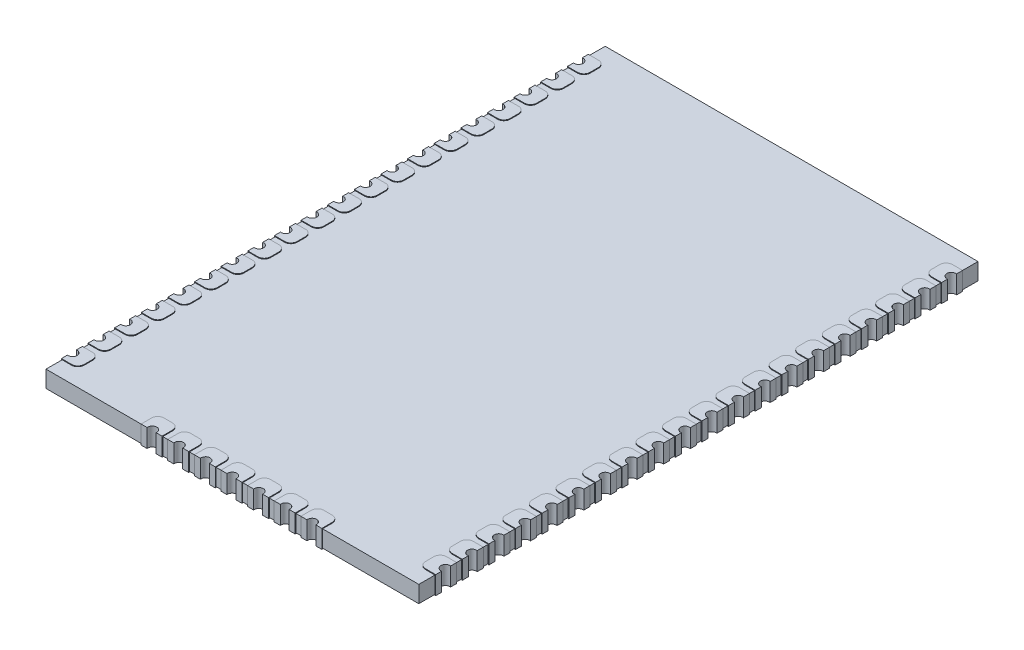
from build123d import *

# Parameters (mm, degrees)
SKETCH1_W                   = 17.78
SKETCH1_H                   = 26.67
BOSS_EXTRUDE1_DEPTH         = 0.8
SKETCH2_R                   = 0.25
CUT_EXTRUDE1_DEPTH          = 1
BOSS_EXTRUDE2_DEPTH         = 0.035
BOSS_EXTRUDE2_DEPTH_BACK    = 0.835
BOSS_EXTRUDE2_2_DEPTH       = 0.035
BOSS_EXTRUDE2_2_DEPTH_BACK  = 0.835
BOSS_EXTRUDE2_3_DEPTH       = 0.035
BOSS_EXTRUDE2_3_DEPTH_BACK  = 0.835
BOSS_EXTRUDE2_4_DEPTH       = 0.035
BOSS_EXTRUDE2_4_DEPTH_BACK  = 0.835
BOSS_EXTRUDE2_5_DEPTH       = 0.035
BOSS_EXTRUDE2_5_DEPTH_BACK  = 0.835
BOSS_EXTRUDE2_6_DEPTH       = 0.035
BOSS_EXTRUDE2_6_DEPTH_BACK  = 0.835
BOSS_EXTRUDE2_7_DEPTH       = 0.035
BOSS_EXTRUDE2_7_DEPTH_BACK  = 0.835
BOSS_EXTRUDE2_8_DEPTH       = 0.035
BOSS_EXTRUDE2_8_DEPTH_BACK  = 0.835
BOSS_EXTRUDE2_9_DEPTH       = 0.035
BOSS_EXTRUDE2_9_DEPTH_BACK  = 0.835
BOSS_EXTRUDE2_10_DEPTH      = 0.035
BOSS_EXTRUDE2_10_DEPTH_BACK = 0.835
BOSS_EXTRUDE2_11_DEPTH      = 0.035
BOSS_EXTRUDE2_11_DEPTH_BACK = 0.835
BOSS_EXTRUDE2_12_DEPTH      = 0.035
BOSS_EXTRUDE2_12_DEPTH_BACK = 0.835
BOSS_EXTRUDE2_13_DEPTH      = 0.035
BOSS_EXTRUDE2_13_DEPTH_BACK = 0.835
BOSS_EXTRUDE2_14_DEPTH      = 0.035
BOSS_EXTRUDE2_14_DEPTH_BACK = 0.835
BOSS_EXTRUDE2_15_DEPTH      = 0.035
BOSS_EXTRUDE2_15_DEPTH_BACK = 0.835
BOSS_EXTRUDE2_16_DEPTH      = 0.035
BOSS_EXTRUDE2_16_DEPTH_BACK = 0.835
BOSS_EXTRUDE2_17_DEPTH      = 0.035
BOSS_EXTRUDE2_17_DEPTH_BACK = 0.835
BOSS_EXTRUDE2_18_DEPTH      = 0.035
BOSS_EXTRUDE2_18_DEPTH_BACK = 0.835
BOSS_EXTRUDE2_19_DEPTH      = 0.035
BOSS_EXTRUDE2_19_DEPTH_BACK = 0.835
BOSS_EXTRUDE2_20_DEPTH      = 0.035
BOSS_EXTRUDE2_20_DEPTH_BACK = 0.835
BOSS_EXTRUDE2_21_DEPTH      = 0.035
BOSS_EXTRUDE2_21_DEPTH_BACK = 0.835
BOSS_EXTRUDE2_22_DEPTH      = 0.035
BOSS_EXTRUDE2_22_DEPTH_BACK = 0.835
BOSS_EXTRUDE2_23_DEPTH      = 0.035
BOSS_EXTRUDE2_23_DEPTH_BACK = 0.835
BOSS_EXTRUDE2_24_DEPTH      = 0.035
BOSS_EXTRUDE2_24_DEPTH_BACK = 0.835
BOSS_EXTRUDE2_25_DEPTH      = 0.035
BOSS_EXTRUDE2_25_DEPTH_BACK = 0.835
BOSS_EXTRUDE2_26_DEPTH      = 0.035
BOSS_EXTRUDE2_26_DEPTH_BACK = 0.835
BOSS_EXTRUDE2_27_DEPTH      = 0.035
BOSS_EXTRUDE2_27_DEPTH_BACK = 0.835
BOSS_EXTRUDE2_28_DEPTH      = 0.035
BOSS_EXTRUDE2_28_DEPTH_BACK = 0.835
BOSS_EXTRUDE2_29_DEPTH      = 0.035
BOSS_EXTRUDE2_29_DEPTH_BACK = 0.835
BOSS_EXTRUDE2_30_DEPTH      = 0.035
BOSS_EXTRUDE2_30_DEPTH_BACK = 0.835
BOSS_EXTRUDE2_31_DEPTH      = 0.035
BOSS_EXTRUDE2_31_DEPTH_BACK = 0.835
BOSS_EXTRUDE2_32_DEPTH      = 0.035
BOSS_EXTRUDE2_32_DEPTH_BACK = 0.835
BOSS_EXTRUDE2_33_DEPTH      = 0.035
BOSS_EXTRUDE2_33_DEPTH_BACK = 0.835
BOSS_EXTRUDE2_34_DEPTH      = 0.035
BOSS_EXTRUDE2_34_DEPTH_BACK = 0.835
BOSS_EXTRUDE2_35_DEPTH      = 0.035
BOSS_EXTRUDE2_35_DEPTH_BACK = 0.835
BOSS_EXTRUDE2_36_DEPTH      = 0.035
BOSS_EXTRUDE2_36_DEPTH_BACK = 0.835
BOSS_EXTRUDE2_37_DEPTH      = 0.035
BOSS_EXTRUDE2_37_DEPTH_BACK = 0.835
BOSS_EXTRUDE2_38_DEPTH      = 0.035
BOSS_EXTRUDE2_38_DEPTH_BACK = 0.835
BOSS_EXTRUDE2_39_DEPTH      = 0.035
BOSS_EXTRUDE2_39_DEPTH_BACK = 0.835
BOSS_EXTRUDE2_40_DEPTH      = 0.035
BOSS_EXTRUDE2_40_DEPTH_BACK = 0.835
BOSS_EXTRUDE2_41_DEPTH      = 0.035
BOSS_EXTRUDE2_41_DEPTH_BACK = 0.835
BOSS_EXTRUDE2_42_DEPTH      = 0.035
BOSS_EXTRUDE2_42_DEPTH_BACK = 0.835
BOSS_EXTRUDE2_43_DEPTH      = 0.035
BOSS_EXTRUDE2_43_DEPTH_BACK = 0.835
BOSS_EXTRUDE2_44_DEPTH      = 0.035
BOSS_EXTRUDE2_44_DEPTH_BACK = 0.835
BOSS_EXTRUDE2_45_DEPTH      = 0.035
BOSS_EXTRUDE2_45_DEPTH_BACK = 0.835
BOSS_EXTRUDE2_46_DEPTH      = 0.035
BOSS_EXTRUDE2_46_DEPTH_BACK = 0.835
BOSS_EXTRUDE2_47_DEPTH      = 0.035
BOSS_EXTRUDE2_47_DEPTH_BACK = 0.835


with BuildPart() as part:
    # Sketch1 → Boss-Extrude1 (new body)
    with BuildSketch(Plane(origin=(0, 0, 0), x_dir=(1, 0, 0), z_dir=(0, 1, 0))):
        Rectangle(SKETCH1_W, SKETCH1_H)
    extrude(amount=BOSS_EXTRUDE1_DEPTH)

    # Sketch2 → Cut-Extrude1 (cut)
    with BuildSketch(Plane.XZ):
        with Locations((-8.89, -12.065)):
            Circle(SKETCH2_R)
        with Locations((-8.89, -10.795)):
            Circle(SKETCH2_R)
        with Locations((-8.89, -9.525)):
            Circle(SKETCH2_R)
        with Locations((-8.89, -8.255)):
            Circle(SKETCH2_R)
        with Locations((-8.89, -6.985)):
            Circle(SKETCH2_R)
        with Locations((-8.89, -5.715)):
            Circle(SKETCH2_R)
        with Locations((-8.89, -4.445)):
            Circle(SKETCH2_R)
        with Locations((-8.89, -3.175)):
            Circle(SKETCH2_R)
        with Locations((-8.89, -1.905)):
            Circle(SKETCH2_R)
        with Locations((-8.89, -0.635)):
            Circle(SKETCH2_R)
        with Locations((-8.89, 0.635)):
            Circle(SKETCH2_R)
        with Locations((-8.89, 1.905)):
            Circle(SKETCH2_R)
        with Locations((-8.89, 3.175)):
            Circle(SKETCH2_R)
        with Locations((-8.89, 4.445)):
            Circle(SKETCH2_R)
        with Locations((-8.89, 5.715)):
            Circle(SKETCH2_R)
        with Locations((-8.89, 6.985)):
            Circle(SKETCH2_R)
        with Locations((-8.89, 8.255)):
            Circle(SKETCH2_R)
        with Locations((-8.89, 9.525)):
            Circle(SKETCH2_R)
        with Locations((-8.89, 10.795)):
            Circle(SKETCH2_R)
        with Locations((-8.89, 12.065)):
            Circle(SKETCH2_R)
        with Locations((8.89, -10.795)):
            Circle(SKETCH2_R)
        with Locations((8.89, -9.525)):
            Circle(SKETCH2_R)
        with Locations((8.89, -8.255)):
            Circle(SKETCH2_R)
        with Locations((8.89, -6.985)):
            Circle(SKETCH2_R)
        with Locations((8.89, -5.715)):
            Circle(SKETCH2_R)
        with Locations((8.89, -4.445)):
            Circle(SKETCH2_R)
        with Locations((8.89, -3.175)):
            Circle(SKETCH2_R)
        with Locations((8.89, -1.905)):
            Circle(SKETCH2_R)
        with Locations((8.89, -0.635)):
            Circle(SKETCH2_R)
        with Locations((8.89, 0.635)):
            Circle(SKETCH2_R)
        with Locations((8.89, 1.905)):
            Circle(SKETCH2_R)
        with Locations((8.89, 3.175)):
            Circle(SKETCH2_R)
        with Locations((8.89, 4.445)):
            Circle(SKETCH2_R)
        with Locations((8.89, 5.715)):
            Circle(SKETCH2_R)
        with Locations((8.89, 6.985)):
            Circle(SKETCH2_R)
        with Locations((8.89, 8.255)):
            Circle(SKETCH2_R)
        with Locations((8.89, 9.525)):
            Circle(SKETCH2_R)
        with Locations((8.89, 10.795)):
            Circle(SKETCH2_R)
        with Locations((8.89, 12.065)):
            Circle(SKETCH2_R)
        with Locations((8.89, -12.065)):
            Circle(SKETCH2_R)
        with Locations((-3.81, 13.335)):
            Circle(SKETCH2_R)
        with Locations((-2.54, 13.335)):
            Circle(SKETCH2_R)
        with Locations((-1.27, 13.335)):
            Circle(SKETCH2_R)
        with Locations((0, 13.335)):
            Circle(SKETCH2_R)
        with Locations((1.27, 13.335)):
            Circle(SKETCH2_R)
        with Locations((2.54, 13.335)):
            Circle(SKETCH2_R)
        with Locations((3.81, 13.335)):
            Circle(SKETCH2_R)
    extrude(amount=-CUT_EXTRUDE1_DEPTH, mode=Mode.SUBTRACT)


with BuildPart() as body_2:
    # Sketch3 → Boss-Extrude2 (new, two sides: drawn at the far end of the back side and taken through both)
    with BuildSketch(Plane.XZ.offset(-BOSS_EXTRUDE2_DEPTH_BACK)):
        with BuildLine():
            Line((-8.89, 11.565), (-8.44, 11.565))
            ThreePointArc((-8.44, 11.565), (-8.227867966, 11.652867966), (-8.14, 11.865))
            Line((-8.14, 11.865), (-8.14, 12.265))
            ThreePointArc((-8.14, 12.265), (-8.227867966, 12.477132034), (-8.44, 12.565))
            Line((-8.44, 12.565), (-8.89, 12.565))
            Line((-8.89, 12.565), (-8.925, 12.565))
            Line((-8.925, 12.565), (-8.925, 12.277132034))
            ThreePointArc((-8.925, 12.277132034), (-8.675, 12.065), (-8.925, 11.852867966))
            Line((-8.925, 11.852867966), (-8.925, 11.565))
            Line((-8.925, 11.565), (-8.89, 11.565))
        make_face()
    extrude(amount=BOSS_EXTRUDE2_DEPTH + BOSS_EXTRUDE2_DEPTH_BACK)


with BuildPart() as body_3:
    # Sketch3 → Boss-Extrude2 2 (new, two sides: drawn at the far end of the back side and taken through both)
    with BuildSketch(Plane.XZ.offset(-BOSS_EXTRUDE2_2_DEPTH_BACK)):
        with BuildLine():
            Line((-8.89, 10.295), (-8.44, 10.295))
            ThreePointArc((-8.44, 10.295), (-8.227867966, 10.382867966), (-8.14, 10.595))
            Line((-8.14, 10.595), (-8.14, 10.995))
            ThreePointArc((-8.14, 10.995), (-8.227867966, 11.207132034), (-8.44, 11.295))
            Line((-8.44, 11.295), (-8.89, 11.295))
            Line((-8.89, 11.295), (-8.925, 11.295))
            Line((-8.925, 11.295), (-8.925, 11.007132034))
            ThreePointArc((-8.925, 11.007132034), (-8.675, 10.795), (-8.925, 10.582867966))
            Line((-8.925, 10.582867966), (-8.925, 10.295))
            Line((-8.925, 10.295), (-8.89, 10.295))
        make_face()
    extrude(amount=BOSS_EXTRUDE2_2_DEPTH + BOSS_EXTRUDE2_2_DEPTH_BACK)


with BuildPart() as body_4:
    # Sketch3 → Boss-Extrude2 3 (new, two sides: drawn at the far end of the back side and taken through both)
    with BuildSketch(Plane.XZ.offset(-BOSS_EXTRUDE2_3_DEPTH_BACK)):
        with BuildLine():
            Line((-8.89, 9.025), (-8.44, 9.025))
            ThreePointArc((-8.44, 9.025), (-8.227867966, 9.112867966), (-8.14, 9.325))
            Line((-8.14, 9.325), (-8.14, 9.725))
            ThreePointArc((-8.14, 9.725), (-8.227867966, 9.937132034), (-8.44, 10.025))
            Line((-8.44, 10.025), (-8.89, 10.025))
            Line((-8.89, 10.025), (-8.925, 10.025))
            Line((-8.925, 10.025), (-8.925, 9.737132034))
            ThreePointArc((-8.925, 9.737132034), (-8.675, 9.525), (-8.925, 9.312867966))
            Line((-8.925, 9.312867966), (-8.925, 9.025))
            Line((-8.925, 9.025), (-8.89, 9.025))
        make_face()
    extrude(amount=BOSS_EXTRUDE2_3_DEPTH + BOSS_EXTRUDE2_3_DEPTH_BACK)


with BuildPart() as body_5:
    # Sketch3 → Boss-Extrude2 4 (new, two sides: drawn at the far end of the back side and taken through both)
    with BuildSketch(Plane.XZ.offset(-BOSS_EXTRUDE2_4_DEPTH_BACK)):
        with BuildLine():
            Line((-8.89, 7.755), (-8.44, 7.755))
            ThreePointArc((-8.44, 7.755), (-8.227867966, 7.842867966), (-8.14, 8.055))
            Line((-8.14, 8.055), (-8.14, 8.455))
            ThreePointArc((-8.14, 8.455), (-8.227867966, 8.667132034), (-8.44, 8.755))
            Line((-8.44, 8.755), (-8.89, 8.755))
            Line((-8.89, 8.755), (-8.925, 8.755))
            Line((-8.925, 8.755), (-8.925, 8.467132034))
            ThreePointArc((-8.925, 8.467132034), (-8.675, 8.255), (-8.925, 8.042867966))
            Line((-8.925, 8.042867966), (-8.925, 7.755))
            Line((-8.925, 7.755), (-8.89, 7.755))
        make_face()
    extrude(amount=BOSS_EXTRUDE2_4_DEPTH + BOSS_EXTRUDE2_4_DEPTH_BACK)


with BuildPart() as body_6:
    # Sketch3 → Boss-Extrude2 5 (new, two sides: drawn at the far end of the back side and taken through both)
    with BuildSketch(Plane.XZ.offset(-BOSS_EXTRUDE2_5_DEPTH_BACK)):
        with BuildLine():
            Line((-8.89, 6.485), (-8.44, 6.485))
            ThreePointArc((-8.44, 6.485), (-8.227867966, 6.572867966), (-8.14, 6.785))
            Line((-8.14, 6.785), (-8.14, 7.185))
            ThreePointArc((-8.14, 7.185), (-8.227867966, 7.397132034), (-8.44, 7.485))
            Line((-8.44, 7.485), (-8.89, 7.485))
            Line((-8.89, 7.485), (-8.925, 7.485))
            Line((-8.925, 7.485), (-8.925, 7.197132034))
            ThreePointArc((-8.925, 7.197132034), (-8.675, 6.985), (-8.925, 6.772867966))
            Line((-8.925, 6.772867966), (-8.925, 6.485))
            Line((-8.925, 6.485), (-8.89, 6.485))
        make_face()
    extrude(amount=BOSS_EXTRUDE2_5_DEPTH + BOSS_EXTRUDE2_5_DEPTH_BACK)


with BuildPart() as body_7:
    # Sketch3 → Boss-Extrude2 6 (new, two sides: drawn at the far end of the back side and taken through both)
    with BuildSketch(Plane.XZ.offset(-BOSS_EXTRUDE2_6_DEPTH_BACK)):
        with BuildLine():
            Line((-8.89, 5.215), (-8.44, 5.215))
            ThreePointArc((-8.44, 5.215), (-8.227867966, 5.302867966), (-8.14, 5.515))
            Line((-8.14, 5.515), (-8.14, 5.915))
            ThreePointArc((-8.14, 5.915), (-8.227867966, 6.127132034), (-8.44, 6.215))
            Line((-8.44, 6.215), (-8.89, 6.215))
            Line((-8.89, 6.215), (-8.925, 6.215))
            Line((-8.925, 6.215), (-8.925, 5.927132034))
            ThreePointArc((-8.925, 5.927132034), (-8.675, 5.715), (-8.925, 5.502867966))
            Line((-8.925, 5.502867966), (-8.925, 5.215))
            Line((-8.925, 5.215), (-8.89, 5.215))
        make_face()
    extrude(amount=BOSS_EXTRUDE2_6_DEPTH + BOSS_EXTRUDE2_6_DEPTH_BACK)


with BuildPart() as body_8:
    # Sketch3 → Boss-Extrude2 7 (new, two sides: drawn at the far end of the back side and taken through both)
    with BuildSketch(Plane.XZ.offset(-BOSS_EXTRUDE2_7_DEPTH_BACK)):
        with BuildLine():
            Line((-8.89, 3.945), (-8.44, 3.945))
            ThreePointArc((-8.44, 3.945), (-8.227867966, 4.032867966), (-8.14, 4.245))
            Line((-8.14, 4.245), (-8.14, 4.645))
            ThreePointArc((-8.14, 4.645), (-8.227867966, 4.857132034), (-8.44, 4.945))
            Line((-8.44, 4.945), (-8.89, 4.945))
            Line((-8.89, 4.945), (-8.925, 4.945))
            Line((-8.925, 4.945), (-8.925, 4.657132034))
            ThreePointArc((-8.925, 4.657132034), (-8.675, 4.445), (-8.925, 4.232867966))
            Line((-8.925, 4.232867966), (-8.925, 3.945))
            Line((-8.925, 3.945), (-8.89, 3.945))
        make_face()
    extrude(amount=BOSS_EXTRUDE2_7_DEPTH + BOSS_EXTRUDE2_7_DEPTH_BACK)


with BuildPart() as body_9:
    # Sketch3 → Boss-Extrude2 8 (new, two sides: drawn at the far end of the back side and taken through both)
    with BuildSketch(Plane.XZ.offset(-BOSS_EXTRUDE2_8_DEPTH_BACK)):
        with BuildLine():
            Line((-8.89, 2.675), (-8.44, 2.675))
            ThreePointArc((-8.44, 2.675), (-8.227867966, 2.762867966), (-8.14, 2.975))
            Line((-8.14, 2.975), (-8.14, 3.375))
            ThreePointArc((-8.14, 3.375), (-8.227867966, 3.587132034), (-8.44, 3.675))
            Line((-8.44, 3.675), (-8.89, 3.675))
            Line((-8.89, 3.675), (-8.925, 3.675))
            Line((-8.925, 3.675), (-8.925, 3.387132034))
            ThreePointArc((-8.925, 3.387132034), (-8.675, 3.175), (-8.925, 2.962867966))
            Line((-8.925, 2.962867966), (-8.925, 2.675))
            Line((-8.925, 2.675), (-8.89, 2.675))
        make_face()
    extrude(amount=BOSS_EXTRUDE2_8_DEPTH + BOSS_EXTRUDE2_8_DEPTH_BACK)


with BuildPart() as body_10:
    # Sketch3 → Boss-Extrude2 9 (new, two sides: drawn at the far end of the back side and taken through both)
    with BuildSketch(Plane.XZ.offset(-BOSS_EXTRUDE2_9_DEPTH_BACK)):
        with BuildLine():
            Line((-8.89, 1.405), (-8.44, 1.405))
            ThreePointArc((-8.44, 1.405), (-8.227867966, 1.492867966), (-8.14, 1.705))
            Line((-8.14, 1.705), (-8.14, 2.105))
            ThreePointArc((-8.14, 2.105), (-8.227867966, 2.317132034), (-8.44, 2.405))
            Line((-8.44, 2.405), (-8.89, 2.405))
            Line((-8.89, 2.405), (-8.925, 2.405))
            Line((-8.925, 2.405), (-8.925, 2.117132034))
            ThreePointArc((-8.925, 2.117132034), (-8.675, 1.905), (-8.925, 1.692867966))
            Line((-8.925, 1.692867966), (-8.925, 1.405))
            Line((-8.925, 1.405), (-8.89, 1.405))
        make_face()
    extrude(amount=BOSS_EXTRUDE2_9_DEPTH + BOSS_EXTRUDE2_9_DEPTH_BACK)


with BuildPart() as body_11:
    # Sketch3 → Boss-Extrude2 10 (new, two sides: drawn at the far end of the back side and taken through both)
    with BuildSketch(Plane.XZ.offset(-BOSS_EXTRUDE2_10_DEPTH_BACK)):
        with BuildLine():
            Line((-8.89, 0.135), (-8.44, 0.135))
            ThreePointArc((-8.44, 0.135), (-8.227867966, 0.222867966), (-8.14, 0.435))
            Line((-8.14, 0.435), (-8.14, 0.835))
            ThreePointArc((-8.14, 0.835), (-8.227867966, 1.047132034), (-8.44, 1.135))
            Line((-8.44, 1.135), (-8.89, 1.135))
            Line((-8.89, 1.135), (-8.925, 1.135))
            Line((-8.925, 1.135), (-8.925, 0.847132034))
            ThreePointArc((-8.925, 0.847132034), (-8.675, 0.635), (-8.925, 0.422867966))
            Line((-8.925, 0.422867966), (-8.925, 0.135))
            Line((-8.925, 0.135), (-8.89, 0.135))
        make_face()
    extrude(amount=BOSS_EXTRUDE2_10_DEPTH + BOSS_EXTRUDE2_10_DEPTH_BACK)


with BuildPart() as body_12:
    # Sketch3 → Boss-Extrude2 11 (new, two sides: drawn at the far end of the back side and taken through both)
    with BuildSketch(Plane.XZ.offset(-BOSS_EXTRUDE2_11_DEPTH_BACK)):
        with BuildLine():
            Line((-8.89, -1.135), (-8.44, -1.135))
            ThreePointArc((-8.44, -1.135), (-8.227867966, -1.047132034), (-8.14, -0.835))
            Line((-8.14, -0.835), (-8.14, -0.435))
            ThreePointArc((-8.14, -0.435), (-8.227867966, -0.222867966), (-8.44, -0.135))
            Line((-8.44, -0.135), (-8.89, -0.135))
            Line((-8.89, -0.135), (-8.925, -0.135))
            Line((-8.925, -0.135), (-8.925, -0.422867966))
            ThreePointArc((-8.925, -0.422867966), (-8.675, -0.635), (-8.925, -0.847132034))
            Line((-8.925, -0.847132034), (-8.925, -1.135))
            Line((-8.925, -1.135), (-8.89, -1.135))
        make_face()
    extrude(amount=BOSS_EXTRUDE2_11_DEPTH + BOSS_EXTRUDE2_11_DEPTH_BACK)


with BuildPart() as body_13:
    # Sketch3 → Boss-Extrude2 12 (new, two sides: drawn at the far end of the back side and taken through both)
    with BuildSketch(Plane.XZ.offset(-BOSS_EXTRUDE2_12_DEPTH_BACK)):
        with BuildLine():
            Line((-8.89, -2.405), (-8.44, -2.405))
            ThreePointArc((-8.44, -2.405), (-8.227867966, -2.317132034), (-8.14, -2.105))
            Line((-8.14, -2.105), (-8.14, -1.705))
            ThreePointArc((-8.14, -1.705), (-8.227867966, -1.492867966), (-8.44, -1.405))
            Line((-8.44, -1.405), (-8.89, -1.405))
            Line((-8.89, -1.405), (-8.925, -1.405))
            Line((-8.925, -1.405), (-8.925, -1.692867966))
            ThreePointArc((-8.925, -1.692867966), (-8.675, -1.905), (-8.925, -2.117132034))
            Line((-8.925, -2.117132034), (-8.925, -2.405))
            Line((-8.925, -2.405), (-8.89, -2.405))
        make_face()
    extrude(amount=BOSS_EXTRUDE2_12_DEPTH + BOSS_EXTRUDE2_12_DEPTH_BACK)


with BuildPart() as body_14:
    # Sketch3 → Boss-Extrude2 13 (new, two sides: drawn at the far end of the back side and taken through both)
    with BuildSketch(Plane.XZ.offset(-BOSS_EXTRUDE2_13_DEPTH_BACK)):
        with BuildLine():
            Line((-8.89, -3.675), (-8.44, -3.675))
            ThreePointArc((-8.44, -3.675), (-8.227867966, -3.587132034), (-8.14, -3.375))
            Line((-8.14, -3.375), (-8.14, -2.975))
            ThreePointArc((-8.14, -2.975), (-8.227867966, -2.762867966), (-8.44, -2.675))
            Line((-8.44, -2.675), (-8.89, -2.675))
            Line((-8.89, -2.675), (-8.925, -2.675))
            Line((-8.925, -2.675), (-8.925, -2.962867966))
            ThreePointArc((-8.925, -2.962867966), (-8.675, -3.175), (-8.925, -3.387132034))
            Line((-8.925, -3.387132034), (-8.925, -3.675))
            Line((-8.925, -3.675), (-8.89, -3.675))
        make_face()
    extrude(amount=BOSS_EXTRUDE2_13_DEPTH + BOSS_EXTRUDE2_13_DEPTH_BACK)


with BuildPart() as body_15:
    # Sketch3 → Boss-Extrude2 14 (new, two sides: drawn at the far end of the back side and taken through both)
    with BuildSketch(Plane.XZ.offset(-BOSS_EXTRUDE2_14_DEPTH_BACK)):
        with BuildLine():
            Line((-8.89, -4.945), (-8.44, -4.945))
            ThreePointArc((-8.44, -4.945), (-8.227867966, -4.857132034), (-8.14, -4.645))
            Line((-8.14, -4.645), (-8.14, -4.245))
            ThreePointArc((-8.14, -4.245), (-8.227867966, -4.032867966), (-8.44, -3.945))
            Line((-8.44, -3.945), (-8.89, -3.945))
            Line((-8.89, -3.945), (-8.925, -3.945))
            Line((-8.925, -3.945), (-8.925, -4.232867966))
            ThreePointArc((-8.925, -4.232867966), (-8.675, -4.445), (-8.925, -4.657132034))
            Line((-8.925, -4.657132034), (-8.925, -4.945))
            Line((-8.925, -4.945), (-8.89, -4.945))
        make_face()
    extrude(amount=BOSS_EXTRUDE2_14_DEPTH + BOSS_EXTRUDE2_14_DEPTH_BACK)


with BuildPart() as body_16:
    # Sketch3 → Boss-Extrude2 15 (new, two sides: drawn at the far end of the back side and taken through both)
    with BuildSketch(Plane.XZ.offset(-BOSS_EXTRUDE2_15_DEPTH_BACK)):
        with BuildLine():
            Line((-8.89, -6.215), (-8.44, -6.215))
            ThreePointArc((-8.44, -6.215), (-8.227867966, -6.127132034), (-8.14, -5.915))
            Line((-8.14, -5.915), (-8.14, -5.515))
            ThreePointArc((-8.14, -5.515), (-8.227867966, -5.302867966), (-8.44, -5.215))
            Line((-8.44, -5.215), (-8.89, -5.215))
            Line((-8.89, -5.215), (-8.925, -5.215))
            Line((-8.925, -5.215), (-8.925, -5.502867966))
            ThreePointArc((-8.925, -5.502867966), (-8.675, -5.715), (-8.925, -5.927132034))
            Line((-8.925, -5.927132034), (-8.925, -6.215))
            Line((-8.925, -6.215), (-8.89, -6.215))
        make_face()
    extrude(amount=BOSS_EXTRUDE2_15_DEPTH + BOSS_EXTRUDE2_15_DEPTH_BACK)


with BuildPart() as body_17:
    # Sketch3 → Boss-Extrude2 16 (new, two sides: drawn at the far end of the back side and taken through both)
    with BuildSketch(Plane.XZ.offset(-BOSS_EXTRUDE2_16_DEPTH_BACK)):
        with BuildLine():
            Line((-8.89, -7.485), (-8.44, -7.485))
            ThreePointArc((-8.44, -7.485), (-8.227867966, -7.397132034), (-8.14, -7.185))
            Line((-8.14, -7.185), (-8.14, -6.785))
            ThreePointArc((-8.14, -6.785), (-8.227867966, -6.572867966), (-8.44, -6.485))
            Line((-8.44, -6.485), (-8.89, -6.485))
            Line((-8.89, -6.485), (-8.925, -6.485))
            Line((-8.925, -6.485), (-8.925, -6.772867966))
            ThreePointArc((-8.925, -6.772867966), (-8.675, -6.985), (-8.925, -7.197132034))
            Line((-8.925, -7.197132034), (-8.925, -7.485))
            Line((-8.925, -7.485), (-8.89, -7.485))
        make_face()
    extrude(amount=BOSS_EXTRUDE2_16_DEPTH + BOSS_EXTRUDE2_16_DEPTH_BACK)


with BuildPart() as body_18:
    # Sketch3 → Boss-Extrude2 17 (new, two sides: drawn at the far end of the back side and taken through both)
    with BuildSketch(Plane.XZ.offset(-BOSS_EXTRUDE2_17_DEPTH_BACK)):
        with BuildLine():
            Line((-8.89, -8.755), (-8.44, -8.755))
            ThreePointArc((-8.44, -8.755), (-8.227867966, -8.667132034), (-8.14, -8.455))
            Line((-8.14, -8.455), (-8.14, -8.055))
            ThreePointArc((-8.14, -8.055), (-8.227867966, -7.842867966), (-8.44, -7.755))
            Line((-8.44, -7.755), (-8.89, -7.755))
            Line((-8.89, -7.755), (-8.925, -7.755))
            Line((-8.925, -7.755), (-8.925, -8.042867966))
            ThreePointArc((-8.925, -8.042867966), (-8.675, -8.255), (-8.925, -8.467132034))
            Line((-8.925, -8.467132034), (-8.925, -8.755))
            Line((-8.925, -8.755), (-8.89, -8.755))
        make_face()
    extrude(amount=BOSS_EXTRUDE2_17_DEPTH + BOSS_EXTRUDE2_17_DEPTH_BACK)


with BuildPart() as body_19:
    # Sketch3 → Boss-Extrude2 18 (new, two sides: drawn at the far end of the back side and taken through both)
    with BuildSketch(Plane.XZ.offset(-BOSS_EXTRUDE2_18_DEPTH_BACK)):
        with BuildLine():
            Line((-8.89, -10.025), (-8.44, -10.025))
            ThreePointArc((-8.44, -10.025), (-8.227867966, -9.937132034), (-8.14, -9.725))
            Line((-8.14, -9.725), (-8.14, -9.325))
            ThreePointArc((-8.14, -9.325), (-8.227867966, -9.112867966), (-8.44, -9.025))
            Line((-8.44, -9.025), (-8.89, -9.025))
            Line((-8.89, -9.025), (-8.925, -9.025))
            Line((-8.925, -9.025), (-8.925, -9.312867966))
            ThreePointArc((-8.925, -9.312867966), (-8.675, -9.525), (-8.925, -9.737132034))
            Line((-8.925, -9.737132034), (-8.925, -10.025))
            Line((-8.925, -10.025), (-8.89, -10.025))
        make_face()
    extrude(amount=BOSS_EXTRUDE2_18_DEPTH + BOSS_EXTRUDE2_18_DEPTH_BACK)


with BuildPart() as body_20:
    # Sketch3 → Boss-Extrude2 19 (new, two sides: drawn at the far end of the back side and taken through both)
    with BuildSketch(Plane.XZ.offset(-BOSS_EXTRUDE2_19_DEPTH_BACK)):
        with BuildLine():
            Line((-8.89, -11.295), (-8.44, -11.295))
            ThreePointArc((-8.44, -11.295), (-8.227867966, -11.207132034), (-8.14, -10.995))
            Line((-8.14, -10.995), (-8.14, -10.595))
            ThreePointArc((-8.14, -10.595), (-8.227867966, -10.382867966), (-8.44, -10.295))
            Line((-8.44, -10.295), (-8.89, -10.295))
            Line((-8.89, -10.295), (-8.925, -10.295))
            Line((-8.925, -10.295), (-8.925, -10.582867966))
            ThreePointArc((-8.925, -10.582867966), (-8.675, -10.795), (-8.925, -11.007132034))
            Line((-8.925, -11.007132034), (-8.925, -11.295))
            Line((-8.925, -11.295), (-8.89, -11.295))
        make_face()
    extrude(amount=BOSS_EXTRUDE2_19_DEPTH + BOSS_EXTRUDE2_19_DEPTH_BACK)


with BuildPart() as body_21:
    # Sketch3 → Boss-Extrude2 20 (new, two sides: drawn at the far end of the back side and taken through both)
    with BuildSketch(Plane.XZ.offset(-BOSS_EXTRUDE2_20_DEPTH_BACK)):
        with BuildLine():
            Line((-8.89, -12.565), (-8.44, -12.565))
            ThreePointArc((-8.44, -12.565), (-8.227867966, -12.477132034), (-8.14, -12.265))
            Line((-8.14, -12.265), (-8.14, -11.865))
            ThreePointArc((-8.14, -11.865), (-8.227867966, -11.652867966), (-8.44, -11.565))
            Line((-8.44, -11.565), (-8.89, -11.565))
            Line((-8.89, -11.565), (-8.925, -11.565))
            Line((-8.925, -11.565), (-8.925, -11.852867966))
            ThreePointArc((-8.925, -11.852867966), (-8.675, -12.065), (-8.925, -12.277132034))
            Line((-8.925, -12.277132034), (-8.925, -12.565))
            Line((-8.925, -12.565), (-8.89, -12.565))
        make_face()
    extrude(amount=BOSS_EXTRUDE2_20_DEPTH + BOSS_EXTRUDE2_20_DEPTH_BACK)


with BuildPart() as body_22:
    # Sketch3 → Boss-Extrude2 21 (new, two sides: drawn at the far end of the back side and taken through both)
    with BuildSketch(Plane.XZ.offset(-BOSS_EXTRUDE2_21_DEPTH_BACK)):
        with BuildLine():
            Line((8.14, -11.865), (8.14, -12.265))
            ThreePointArc((8.14, -12.265), (8.227867966, -12.477132034), (8.44, -12.565))
            Line((8.44, -12.565), (8.89, -12.565))
            Line((8.89, -12.565), (8.925, -12.565))
            Line((8.925, -12.565), (8.925, -12.277132034))
            ThreePointArc((8.925, -12.277132034), (8.675, -12.065), (8.925, -11.852867966))
            Line((8.925, -11.852867966), (8.925, -11.565))
            Line((8.925, -11.565), (8.89, -11.565))
            Line((8.89, -11.565), (8.44, -11.565))
            ThreePointArc((8.44, -11.565), (8.227867966, -11.652867966), (8.14, -11.865))
        make_face()
    extrude(amount=BOSS_EXTRUDE2_21_DEPTH + BOSS_EXTRUDE2_21_DEPTH_BACK)


with BuildPart() as body_23:
    # Sketch3 → Boss-Extrude2 22 (new, two sides: drawn at the far end of the back side and taken through both)
    with BuildSketch(Plane.XZ.offset(-BOSS_EXTRUDE2_22_DEPTH_BACK)):
        with BuildLine():
            Line((8.14, -10.595), (8.14, -10.995))
            ThreePointArc((8.14, -10.995), (8.227867966, -11.207132034), (8.44, -11.295))
            Line((8.44, -11.295), (8.89, -11.295))
            Line((8.89, -11.295), (8.925, -11.295))
            Line((8.925, -11.295), (8.925, -11.007132034))
            ThreePointArc((8.925, -11.007132034), (8.675, -10.795), (8.925, -10.582867966))
            Line((8.925, -10.582867966), (8.925, -10.295))
            Line((8.925, -10.295), (8.89, -10.295))
            Line((8.89, -10.295), (8.44, -10.295))
            ThreePointArc((8.44, -10.295), (8.227867966, -10.382867966), (8.14, -10.595))
        make_face()
    extrude(amount=BOSS_EXTRUDE2_22_DEPTH + BOSS_EXTRUDE2_22_DEPTH_BACK)


with BuildPart() as body_24:
    # Sketch3 → Boss-Extrude2 23 (new, two sides: drawn at the far end of the back side and taken through both)
    with BuildSketch(Plane.XZ.offset(-BOSS_EXTRUDE2_23_DEPTH_BACK)):
        with BuildLine():
            Line((8.14, -9.325), (8.14, -9.725))
            ThreePointArc((8.14, -9.725), (8.227867966, -9.937132034), (8.44, -10.025))
            Line((8.44, -10.025), (8.89, -10.025))
            Line((8.89, -10.025), (8.925, -10.025))
            Line((8.925, -10.025), (8.925, -9.737132034))
            ThreePointArc((8.925, -9.737132034), (8.675, -9.525), (8.925, -9.312867966))
            Line((8.925, -9.312867966), (8.925, -9.025))
            Line((8.925, -9.025), (8.89, -9.025))
            Line((8.89, -9.025), (8.44, -9.025))
            ThreePointArc((8.44, -9.025), (8.227867966, -9.112867966), (8.14, -9.325))
        make_face()
    extrude(amount=BOSS_EXTRUDE2_23_DEPTH + BOSS_EXTRUDE2_23_DEPTH_BACK)


with BuildPart() as body_25:
    # Sketch3 → Boss-Extrude2 24 (new, two sides: drawn at the far end of the back side and taken through both)
    with BuildSketch(Plane.XZ.offset(-BOSS_EXTRUDE2_24_DEPTH_BACK)):
        with BuildLine():
            Line((8.14, -8.055), (8.14, -8.455))
            ThreePointArc((8.14, -8.455), (8.227867966, -8.667132034), (8.44, -8.755))
            Line((8.44, -8.755), (8.89, -8.755))
            Line((8.89, -8.755), (8.925, -8.755))
            Line((8.925, -8.755), (8.925, -8.467132034))
            ThreePointArc((8.925, -8.467132034), (8.675, -8.255), (8.925, -8.042867966))
            Line((8.925, -8.042867966), (8.925, -7.755))
            Line((8.925, -7.755), (8.89, -7.755))
            Line((8.89, -7.755), (8.44, -7.755))
            ThreePointArc((8.44, -7.755), (8.227867966, -7.842867966), (8.14, -8.055))
        make_face()
    extrude(amount=BOSS_EXTRUDE2_24_DEPTH + BOSS_EXTRUDE2_24_DEPTH_BACK)


with BuildPart() as body_26:
    # Sketch3 → Boss-Extrude2 25 (new, two sides: drawn at the far end of the back side and taken through both)
    with BuildSketch(Plane.XZ.offset(-BOSS_EXTRUDE2_25_DEPTH_BACK)):
        with BuildLine():
            Line((8.14, -6.785), (8.14, -7.185))
            ThreePointArc((8.14, -7.185), (8.227867966, -7.397132034), (8.44, -7.485))
            Line((8.44, -7.485), (8.89, -7.485))
            Line((8.89, -7.485), (8.925, -7.485))
            Line((8.925, -7.485), (8.925, -7.197132034))
            ThreePointArc((8.925, -7.197132034), (8.675, -6.985), (8.925, -6.772867966))
            Line((8.925, -6.772867966), (8.925, -6.485))
            Line((8.925, -6.485), (8.89, -6.485))
            Line((8.89, -6.485), (8.44, -6.485))
            ThreePointArc((8.44, -6.485), (8.227867966, -6.572867966), (8.14, -6.785))
        make_face()
    extrude(amount=BOSS_EXTRUDE2_25_DEPTH + BOSS_EXTRUDE2_25_DEPTH_BACK)


with BuildPart() as body_27:
    # Sketch3 → Boss-Extrude2 26 (new, two sides: drawn at the far end of the back side and taken through both)
    with BuildSketch(Plane.XZ.offset(-BOSS_EXTRUDE2_26_DEPTH_BACK)):
        with BuildLine():
            Line((8.14, -5.515), (8.14, -5.915))
            ThreePointArc((8.14, -5.915), (8.227867966, -6.127132034), (8.44, -6.215))
            Line((8.44, -6.215), (8.89, -6.215))
            Line((8.89, -6.215), (8.925, -6.215))
            Line((8.925, -6.215), (8.925, -5.927132034))
            ThreePointArc((8.925, -5.927132034), (8.675, -5.715), (8.925, -5.502867966))
            Line((8.925, -5.502867966), (8.925, -5.215))
            Line((8.925, -5.215), (8.89, -5.215))
            Line((8.89, -5.215), (8.44, -5.215))
            ThreePointArc((8.44, -5.215), (8.227867966, -5.302867966), (8.14, -5.515))
        make_face()
    extrude(amount=BOSS_EXTRUDE2_26_DEPTH + BOSS_EXTRUDE2_26_DEPTH_BACK)


with BuildPart() as body_28:
    # Sketch3 → Boss-Extrude2 27 (new, two sides: drawn at the far end of the back side and taken through both)
    with BuildSketch(Plane.XZ.offset(-BOSS_EXTRUDE2_27_DEPTH_BACK)):
        with BuildLine():
            Line((8.14, -4.245), (8.14, -4.645))
            ThreePointArc((8.14, -4.645), (8.227867966, -4.857132034), (8.44, -4.945))
            Line((8.44, -4.945), (8.89, -4.945))
            Line((8.89, -4.945), (8.925, -4.945))
            Line((8.925, -4.945), (8.925, -4.657132034))
            ThreePointArc((8.925, -4.657132034), (8.675, -4.445), (8.925, -4.232867966))
            Line((8.925, -4.232867966), (8.925, -3.945))
            Line((8.925, -3.945), (8.89, -3.945))
            Line((8.89, -3.945), (8.44, -3.945))
            ThreePointArc((8.44, -3.945), (8.227867966, -4.032867966), (8.14, -4.245))
        make_face()
    extrude(amount=BOSS_EXTRUDE2_27_DEPTH + BOSS_EXTRUDE2_27_DEPTH_BACK)


with BuildPart() as body_29:
    # Sketch3 → Boss-Extrude2 28 (new, two sides: drawn at the far end of the back side and taken through both)
    with BuildSketch(Plane.XZ.offset(-BOSS_EXTRUDE2_28_DEPTH_BACK)):
        with BuildLine():
            Line((8.14, -2.975), (8.14, -3.375))
            ThreePointArc((8.14, -3.375), (8.227867966, -3.587132034), (8.44, -3.675))
            Line((8.44, -3.675), (8.89, -3.675))
            Line((8.89, -3.675), (8.925, -3.675))
            Line((8.925, -3.675), (8.925, -3.387132034))
            ThreePointArc((8.925, -3.387132034), (8.675, -3.175), (8.925, -2.962867966))
            Line((8.925, -2.962867966), (8.925, -2.675))
            Line((8.925, -2.675), (8.89, -2.675))
            Line((8.89, -2.675), (8.44, -2.675))
            ThreePointArc((8.44, -2.675), (8.227867966, -2.762867966), (8.14, -2.975))
        make_face()
    extrude(amount=BOSS_EXTRUDE2_28_DEPTH + BOSS_EXTRUDE2_28_DEPTH_BACK)


with BuildPart() as body_30:
    # Sketch3 → Boss-Extrude2 29 (new, two sides: drawn at the far end of the back side and taken through both)
    with BuildSketch(Plane.XZ.offset(-BOSS_EXTRUDE2_29_DEPTH_BACK)):
        with BuildLine():
            Line((8.14, -1.705), (8.14, -2.105))
            ThreePointArc((8.14, -2.105), (8.227867966, -2.317132034), (8.44, -2.405))
            Line((8.44, -2.405), (8.89, -2.405))
            Line((8.89, -2.405), (8.925, -2.405))
            Line((8.925, -2.405), (8.925, -2.117132034))
            ThreePointArc((8.925, -2.117132034), (8.675, -1.905), (8.925, -1.692867966))
            Line((8.925, -1.692867966), (8.925, -1.405))
            Line((8.925, -1.405), (8.89, -1.405))
            Line((8.89, -1.405), (8.44, -1.405))
            ThreePointArc((8.44, -1.405), (8.227867966, -1.492867966), (8.14, -1.705))
        make_face()
    extrude(amount=BOSS_EXTRUDE2_29_DEPTH + BOSS_EXTRUDE2_29_DEPTH_BACK)


with BuildPart() as body_31:
    # Sketch3 → Boss-Extrude2 30 (new, two sides: drawn at the far end of the back side and taken through both)
    with BuildSketch(Plane.XZ.offset(-BOSS_EXTRUDE2_30_DEPTH_BACK)):
        with BuildLine():
            Line((8.14, -0.435), (8.14, -0.835))
            ThreePointArc((8.14, -0.835), (8.227867966, -1.047132034), (8.44, -1.135))
            Line((8.44, -1.135), (8.89, -1.135))
            Line((8.89, -1.135), (8.925, -1.135))
            Line((8.925, -1.135), (8.925, -0.847132034))
            ThreePointArc((8.925, -0.847132034), (8.675, -0.635), (8.925, -0.422867966))
            Line((8.925, -0.422867966), (8.925, -0.135))
            Line((8.925, -0.135), (8.89, -0.135))
            Line((8.89, -0.135), (8.44, -0.135))
            ThreePointArc((8.44, -0.135), (8.227867966, -0.222867966), (8.14, -0.435))
        make_face()
    extrude(amount=BOSS_EXTRUDE2_30_DEPTH + BOSS_EXTRUDE2_30_DEPTH_BACK)


with BuildPart() as body_32:
    # Sketch3 → Boss-Extrude2 31 (new, two sides: drawn at the far end of the back side and taken through both)
    with BuildSketch(Plane.XZ.offset(-BOSS_EXTRUDE2_31_DEPTH_BACK)):
        with BuildLine():
            Line((8.14, 0.835), (8.14, 0.435))
            ThreePointArc((8.14, 0.435), (8.227867966, 0.222867966), (8.44, 0.135))
            Line((8.44, 0.135), (8.89, 0.135))
            Line((8.89, 0.135), (8.925, 0.135))
            Line((8.925, 0.135), (8.925, 0.422867966))
            ThreePointArc((8.925, 0.422867966), (8.675, 0.635), (8.925, 0.847132034))
            Line((8.925, 0.847132034), (8.925, 1.135))
            Line((8.925, 1.135), (8.89, 1.135))
            Line((8.89, 1.135), (8.44, 1.135))
            ThreePointArc((8.44, 1.135), (8.227867966, 1.047132034), (8.14, 0.835))
        make_face()
    extrude(amount=BOSS_EXTRUDE2_31_DEPTH + BOSS_EXTRUDE2_31_DEPTH_BACK)


with BuildPart() as body_33:
    # Sketch3 → Boss-Extrude2 32 (new, two sides: drawn at the far end of the back side and taken through both)
    with BuildSketch(Plane.XZ.offset(-BOSS_EXTRUDE2_32_DEPTH_BACK)):
        with BuildLine():
            Line((8.14, 2.105), (8.14, 1.705))
            ThreePointArc((8.14, 1.705), (8.227867966, 1.492867966), (8.44, 1.405))
            Line((8.44, 1.405), (8.89, 1.405))
            Line((8.89, 1.405), (8.925, 1.405))
            Line((8.925, 1.405), (8.925, 1.692867966))
            ThreePointArc((8.925, 1.692867966), (8.675, 1.905), (8.925, 2.117132034))
            Line((8.925, 2.117132034), (8.925, 2.405))
            Line((8.925, 2.405), (8.89, 2.405))
            Line((8.89, 2.405), (8.44, 2.405))
            ThreePointArc((8.44, 2.405), (8.227867966, 2.317132034), (8.14, 2.105))
        make_face()
    extrude(amount=BOSS_EXTRUDE2_32_DEPTH + BOSS_EXTRUDE2_32_DEPTH_BACK)


with BuildPart() as body_34:
    # Sketch3 → Boss-Extrude2 33 (new, two sides: drawn at the far end of the back side and taken through both)
    with BuildSketch(Plane.XZ.offset(-BOSS_EXTRUDE2_33_DEPTH_BACK)):
        with BuildLine():
            Line((8.14, 3.375), (8.14, 2.975))
            ThreePointArc((8.14, 2.975), (8.227867966, 2.762867966), (8.44, 2.675))
            Line((8.44, 2.675), (8.89, 2.675))
            Line((8.89, 2.675), (8.925, 2.675))
            Line((8.925, 2.675), (8.925, 2.962867966))
            ThreePointArc((8.925, 2.962867966), (8.675, 3.175), (8.925, 3.387132034))
            Line((8.925, 3.387132034), (8.925, 3.675))
            Line((8.925, 3.675), (8.89, 3.675))
            Line((8.89, 3.675), (8.44, 3.675))
            ThreePointArc((8.44, 3.675), (8.227867966, 3.587132034), (8.14, 3.375))
        make_face()
    extrude(amount=BOSS_EXTRUDE2_33_DEPTH + BOSS_EXTRUDE2_33_DEPTH_BACK)


with BuildPart() as body_35:
    # Sketch3 → Boss-Extrude2 34 (new, two sides: drawn at the far end of the back side and taken through both)
    with BuildSketch(Plane.XZ.offset(-BOSS_EXTRUDE2_34_DEPTH_BACK)):
        with BuildLine():
            Line((8.14, 4.645), (8.14, 4.245))
            ThreePointArc((8.14, 4.245), (8.227867966, 4.032867966), (8.44, 3.945))
            Line((8.44, 3.945), (8.89, 3.945))
            Line((8.89, 3.945), (8.925, 3.945))
            Line((8.925, 3.945), (8.925, 4.232867966))
            ThreePointArc((8.925, 4.232867966), (8.675, 4.445), (8.925, 4.657132034))
            Line((8.925, 4.657132034), (8.925, 4.945))
            Line((8.925, 4.945), (8.89, 4.945))
            Line((8.89, 4.945), (8.44, 4.945))
            ThreePointArc((8.44, 4.945), (8.227867966, 4.857132034), (8.14, 4.645))
        make_face()
    extrude(amount=BOSS_EXTRUDE2_34_DEPTH + BOSS_EXTRUDE2_34_DEPTH_BACK)


with BuildPart() as body_36:
    # Sketch3 → Boss-Extrude2 35 (new, two sides: drawn at the far end of the back side and taken through both)
    with BuildSketch(Plane.XZ.offset(-BOSS_EXTRUDE2_35_DEPTH_BACK)):
        with BuildLine():
            Line((8.14, 5.915), (8.14, 5.515))
            ThreePointArc((8.14, 5.515), (8.227867966, 5.302867966), (8.44, 5.215))
            Line((8.44, 5.215), (8.89, 5.215))
            Line((8.89, 5.215), (8.925, 5.215))
            Line((8.925, 5.215), (8.925, 5.502867966))
            ThreePointArc((8.925, 5.502867966), (8.675, 5.715), (8.925, 5.927132034))
            Line((8.925, 5.927132034), (8.925, 6.215))
            Line((8.925, 6.215), (8.89, 6.215))
            Line((8.89, 6.215), (8.44, 6.215))
            ThreePointArc((8.44, 6.215), (8.227867966, 6.127132034), (8.14, 5.915))
        make_face()
    extrude(amount=BOSS_EXTRUDE2_35_DEPTH + BOSS_EXTRUDE2_35_DEPTH_BACK)


with BuildPart() as body_37:
    # Sketch3 → Boss-Extrude2 36 (new, two sides: drawn at the far end of the back side and taken through both)
    with BuildSketch(Plane.XZ.offset(-BOSS_EXTRUDE2_36_DEPTH_BACK)):
        with BuildLine():
            Line((8.14, 7.185), (8.14, 6.785))
            ThreePointArc((8.14, 6.785), (8.227867966, 6.572867966), (8.44, 6.485))
            Line((8.44, 6.485), (8.89, 6.485))
            Line((8.89, 6.485), (8.925, 6.485))
            Line((8.925, 6.485), (8.925, 6.772867966))
            ThreePointArc((8.925, 6.772867966), (8.675, 6.985), (8.925, 7.197132034))
            Line((8.925, 7.197132034), (8.925, 7.485))
            Line((8.925, 7.485), (8.89, 7.485))
            Line((8.89, 7.485), (8.44, 7.485))
            ThreePointArc((8.44, 7.485), (8.227867966, 7.397132034), (8.14, 7.185))
        make_face()
    extrude(amount=BOSS_EXTRUDE2_36_DEPTH + BOSS_EXTRUDE2_36_DEPTH_BACK)


with BuildPart() as body_38:
    # Sketch3 → Boss-Extrude2 37 (new, two sides: drawn at the far end of the back side and taken through both)
    with BuildSketch(Plane.XZ.offset(-BOSS_EXTRUDE2_37_DEPTH_BACK)):
        with BuildLine():
            Line((8.14, 8.455), (8.14, 8.055))
            ThreePointArc((8.14, 8.055), (8.227867966, 7.842867966), (8.44, 7.755))
            Line((8.44, 7.755), (8.89, 7.755))
            Line((8.89, 7.755), (8.925, 7.755))
            Line((8.925, 7.755), (8.925, 8.042867966))
            ThreePointArc((8.925, 8.042867966), (8.675, 8.255), (8.925, 8.467132034))
            Line((8.925, 8.467132034), (8.925, 8.755))
            Line((8.925, 8.755), (8.89, 8.755))
            Line((8.89, 8.755), (8.44, 8.755))
            ThreePointArc((8.44, 8.755), (8.227867966, 8.667132034), (8.14, 8.455))
        make_face()
    extrude(amount=BOSS_EXTRUDE2_37_DEPTH + BOSS_EXTRUDE2_37_DEPTH_BACK)


with BuildPart() as body_39:
    # Sketch3 → Boss-Extrude2 38 (new, two sides: drawn at the far end of the back side and taken through both)
    with BuildSketch(Plane.XZ.offset(-BOSS_EXTRUDE2_38_DEPTH_BACK)):
        with BuildLine():
            Line((8.14, 9.725), (8.14, 9.325))
            ThreePointArc((8.14, 9.325), (8.227867966, 9.112867966), (8.44, 9.025))
            Line((8.44, 9.025), (8.89, 9.025))
            Line((8.89, 9.025), (8.925, 9.025))
            Line((8.925, 9.025), (8.925, 9.312867966))
            ThreePointArc((8.925, 9.312867966), (8.675, 9.525), (8.925, 9.737132034))
            Line((8.925, 9.737132034), (8.925, 10.025))
            Line((8.925, 10.025), (8.89, 10.025))
            Line((8.89, 10.025), (8.44, 10.025))
            ThreePointArc((8.44, 10.025), (8.227867966, 9.937132034), (8.14, 9.725))
        make_face()
    extrude(amount=BOSS_EXTRUDE2_38_DEPTH + BOSS_EXTRUDE2_38_DEPTH_BACK)


with BuildPart() as body_40:
    # Sketch3 → Boss-Extrude2 39 (new, two sides: drawn at the far end of the back side and taken through both)
    with BuildSketch(Plane.XZ.offset(-BOSS_EXTRUDE2_39_DEPTH_BACK)):
        with BuildLine():
            Line((8.14, 10.995), (8.14, 10.595))
            ThreePointArc((8.14, 10.595), (8.227867966, 10.382867966), (8.44, 10.295))
            Line((8.44, 10.295), (8.89, 10.295))
            Line((8.89, 10.295), (8.925, 10.295))
            Line((8.925, 10.295), (8.925, 10.582867966))
            ThreePointArc((8.925, 10.582867966), (8.675, 10.795), (8.925, 11.007132034))
            Line((8.925, 11.007132034), (8.925, 11.295))
            Line((8.925, 11.295), (8.89, 11.295))
            Line((8.89, 11.295), (8.44, 11.295))
            ThreePointArc((8.44, 11.295), (8.227867966, 11.207132034), (8.14, 10.995))
        make_face()
    extrude(amount=BOSS_EXTRUDE2_39_DEPTH + BOSS_EXTRUDE2_39_DEPTH_BACK)


with BuildPart() as body_41:
    # Sketch3 → Boss-Extrude2 40 (new, two sides: drawn at the far end of the back side and taken through both)
    with BuildSketch(Plane.XZ.offset(-BOSS_EXTRUDE2_40_DEPTH_BACK)):
        with BuildLine():
            Line((8.14, 12.265), (8.14, 11.865))
            ThreePointArc((8.14, 11.865), (8.227867966, 11.652867966), (8.44, 11.565))
            Line((8.44, 11.565), (8.89, 11.565))
            Line((8.89, 11.565), (8.925, 11.565))
            Line((8.925, 11.565), (8.925, 11.852867966))
            ThreePointArc((8.925, 11.852867966), (8.675, 12.065), (8.925, 12.277132034))
            Line((8.925, 12.277132034), (8.925, 12.565))
            Line((8.925, 12.565), (8.89, 12.565))
            Line((8.89, 12.565), (8.44, 12.565))
            ThreePointArc((8.44, 12.565), (8.227867966, 12.477132034), (8.14, 12.265))
        make_face()
    extrude(amount=BOSS_EXTRUDE2_40_DEPTH + BOSS_EXTRUDE2_40_DEPTH_BACK)


with BuildPart() as body_42:
    # Sketch3 → Boss-Extrude2 41 (new, two sides: drawn at the far end of the back side and taken through both)
    with BuildSketch(Plane.XZ.offset(-BOSS_EXTRUDE2_41_DEPTH_BACK)):
        with BuildLine():
            Line((-3.607867966, 13.37), (-3.32, 13.37))
            Line((-3.32, 13.37), (-3.32, 13.335))
            Line((-3.32, 13.335), (-3.32, 12.875))
            ThreePointArc((-3.32, 12.875), (-3.407867966, 12.662867966), (-3.62, 12.575))
            Line((-3.62, 12.575), (-4.02, 12.575))
            ThreePointArc((-4.02, 12.575), (-4.232132034, 12.662867966), (-4.32, 12.875))
            Line((-4.32, 12.875), (-4.32, 13.335))
            Line((-4.32, 13.335), (-4.32, 13.37))
            Line((-4.32, 13.37), (-4.032132034, 13.37))
            ThreePointArc((-4.032132034, 13.37), (-3.82, 13.12), (-3.607867966, 13.37))
        make_face()
    extrude(amount=BOSS_EXTRUDE2_41_DEPTH + BOSS_EXTRUDE2_41_DEPTH_BACK)


with BuildPart() as body_43:
    # Sketch3 → Boss-Extrude2 42 (new, two sides: drawn at the far end of the back side and taken through both)
    with BuildSketch(Plane.XZ.offset(-BOSS_EXTRUDE2_42_DEPTH_BACK)):
        with BuildLine():
            Line((-2.337867966, 13.37), (-2.05, 13.37))
            Line((-2.05, 13.37), (-2.05, 13.335))
            Line((-2.05, 13.335), (-2.05, 12.875))
            ThreePointArc((-2.05, 12.875), (-2.137867966, 12.662867966), (-2.35, 12.575))
            Line((-2.35, 12.575), (-2.75, 12.575))
            ThreePointArc((-2.75, 12.575), (-2.962132034, 12.662867966), (-3.05, 12.875))
            Line((-3.05, 12.875), (-3.05, 13.335))
            Line((-3.05, 13.335), (-3.05, 13.37))
            Line((-3.05, 13.37), (-2.762132034, 13.37))
            ThreePointArc((-2.762132034, 13.37), (-2.55, 13.12), (-2.337867966, 13.37))
        make_face()
    extrude(amount=BOSS_EXTRUDE2_42_DEPTH + BOSS_EXTRUDE2_42_DEPTH_BACK)


with BuildPart() as body_44:
    # Sketch3 → Boss-Extrude2 43 (new, two sides: drawn at the far end of the back side and taken through both)
    with BuildSketch(Plane.XZ.offset(-BOSS_EXTRUDE2_43_DEPTH_BACK)):
        with BuildLine():
            Line((-1.067867966, 13.37), (-0.78, 13.37))
            Line((-0.78, 13.37), (-0.78, 13.335))
            Line((-0.78, 13.335), (-0.78, 12.875))
            ThreePointArc((-0.78, 12.875), (-0.867867966, 12.662867966), (-1.08, 12.575))
            Line((-1.08, 12.575), (-1.48, 12.575))
            ThreePointArc((-1.48, 12.575), (-1.692132034, 12.662867966), (-1.78, 12.875))
            Line((-1.78, 12.875), (-1.78, 13.335))
            Line((-1.78, 13.335), (-1.78, 13.37))
            Line((-1.78, 13.37), (-1.492132034, 13.37))
            ThreePointArc((-1.492132034, 13.37), (-1.28, 13.12), (-1.067867966, 13.37))
        make_face()
    extrude(amount=BOSS_EXTRUDE2_43_DEPTH + BOSS_EXTRUDE2_43_DEPTH_BACK)


with BuildPart() as body_45:
    # Sketch3 → Boss-Extrude2 44 (new, two sides: drawn at the far end of the back side and taken through both)
    with BuildSketch(Plane.XZ.offset(-BOSS_EXTRUDE2_44_DEPTH_BACK)):
        with BuildLine():
            Line((0.202132034, 13.37), (0.49, 13.37))
            Line((0.49, 13.37), (0.49, 13.335))
            Line((0.49, 13.335), (0.49, 12.875))
            ThreePointArc((0.49, 12.875), (0.402132034, 12.662867966), (0.19, 12.575))
            Line((0.19, 12.575), (-0.21, 12.575))
            ThreePointArc((-0.21, 12.575), (-0.422132034, 12.662867966), (-0.51, 12.875))
            Line((-0.51, 12.875), (-0.51, 13.335))
            Line((-0.51, 13.335), (-0.51, 13.37))
            Line((-0.51, 13.37), (-0.222132034, 13.37))
            ThreePointArc((-0.222132034, 13.37), (-0.01, 13.12), (0.202132034, 13.37))
        make_face()
    extrude(amount=BOSS_EXTRUDE2_44_DEPTH + BOSS_EXTRUDE2_44_DEPTH_BACK)


with BuildPart() as body_46:
    # Sketch3 → Boss-Extrude2 45 (new, two sides: drawn at the far end of the back side and taken through both)
    with BuildSketch(Plane.XZ.offset(-BOSS_EXTRUDE2_45_DEPTH_BACK)):
        with BuildLine():
            Line((1.472132034, 13.37), (1.76, 13.37))
            Line((1.76, 13.37), (1.76, 13.335))
            Line((1.76, 13.335), (1.76, 12.875))
            ThreePointArc((1.76, 12.875), (1.672132034, 12.662867966), (1.46, 12.575))
            Line((1.46, 12.575), (1.06, 12.575))
            ThreePointArc((1.06, 12.575), (0.847867966, 12.662867966), (0.76, 12.875))
            Line((0.76, 12.875), (0.76, 13.335))
            Line((0.76, 13.335), (0.76, 13.37))
            Line((0.76, 13.37), (1.047867966, 13.37))
            ThreePointArc((1.047867966, 13.37), (1.26, 13.12), (1.472132034, 13.37))
        make_face()
    extrude(amount=BOSS_EXTRUDE2_45_DEPTH + BOSS_EXTRUDE2_45_DEPTH_BACK)


with BuildPart() as body_47:
    # Sketch3 → Boss-Extrude2 46 (new, two sides: drawn at the far end of the back side and taken through both)
    with BuildSketch(Plane.XZ.offset(-BOSS_EXTRUDE2_46_DEPTH_BACK)):
        with BuildLine():
            Line((2.742132034, 13.37), (3.03, 13.37))
            Line((3.03, 13.37), (3.03, 13.335))
            Line((3.03, 13.335), (3.03, 12.875))
            ThreePointArc((3.03, 12.875), (2.942132034, 12.662867966), (2.73, 12.575))
            Line((2.73, 12.575), (2.33, 12.575))
            ThreePointArc((2.33, 12.575), (2.117867966, 12.662867966), (2.03, 12.875))
            Line((2.03, 12.875), (2.03, 13.335))
            Line((2.03, 13.335), (2.03, 13.37))
            Line((2.03, 13.37), (2.317867966, 13.37))
            ThreePointArc((2.317867966, 13.37), (2.53, 13.12), (2.742132034, 13.37))
        make_face()
    extrude(amount=BOSS_EXTRUDE2_46_DEPTH + BOSS_EXTRUDE2_46_DEPTH_BACK)


with BuildPart() as body_48:
    # Sketch3 → Boss-Extrude2 47 (new, two sides: drawn at the far end of the back side and taken through both)
    with BuildSketch(Plane.XZ.offset(-BOSS_EXTRUDE2_47_DEPTH_BACK)):
        with BuildLine():
            Line((4.012132034, 13.37), (4.3, 13.37))
            Line((4.3, 13.37), (4.3, 13.335))
            Line((4.3, 13.335), (4.3, 12.875))
            ThreePointArc((4.3, 12.875), (4.212132034, 12.662867966), (4, 12.575))
            Line((4, 12.575), (3.6, 12.575))
            ThreePointArc((3.6, 12.575), (3.387867966, 12.662867966), (3.3, 12.875))
            Line((3.3, 12.875), (3.3, 13.335))
            Line((3.3, 13.335), (3.3, 13.37))
            Line((3.3, 13.37), (3.587867966, 13.37))
            ThreePointArc((3.587867966, 13.37), (3.8, 13.12), (4.012132034, 13.37))
        make_face()
    extrude(amount=BOSS_EXTRUDE2_47_DEPTH + BOSS_EXTRUDE2_47_DEPTH_BACK)


solid = Compound([part.part, body_2.part, body_3.part, body_4.part, body_5.part, body_6.part, body_7.part, body_8.part, body_9.part, body_10.part, body_11.part, body_12.part, body_13.part, body_14.part, body_15.part, body_16.part, body_17.part, body_18.part, body_19.part, body_20.part, body_21.part, body_22.part, body_23.part, body_24.part, body_25.part, body_26.part, body_27.part, body_28.part, body_29.part, body_30.part, body_31.part, body_32.part, body_33.part, body_34.part, body_35.part, body_36.part, body_37.part, body_38.part, body_39.part, body_40.part, body_41.part, body_42.part, body_43.part, body_44.part, body_45.part, body_46.part, body_47.part, body_48.part])
